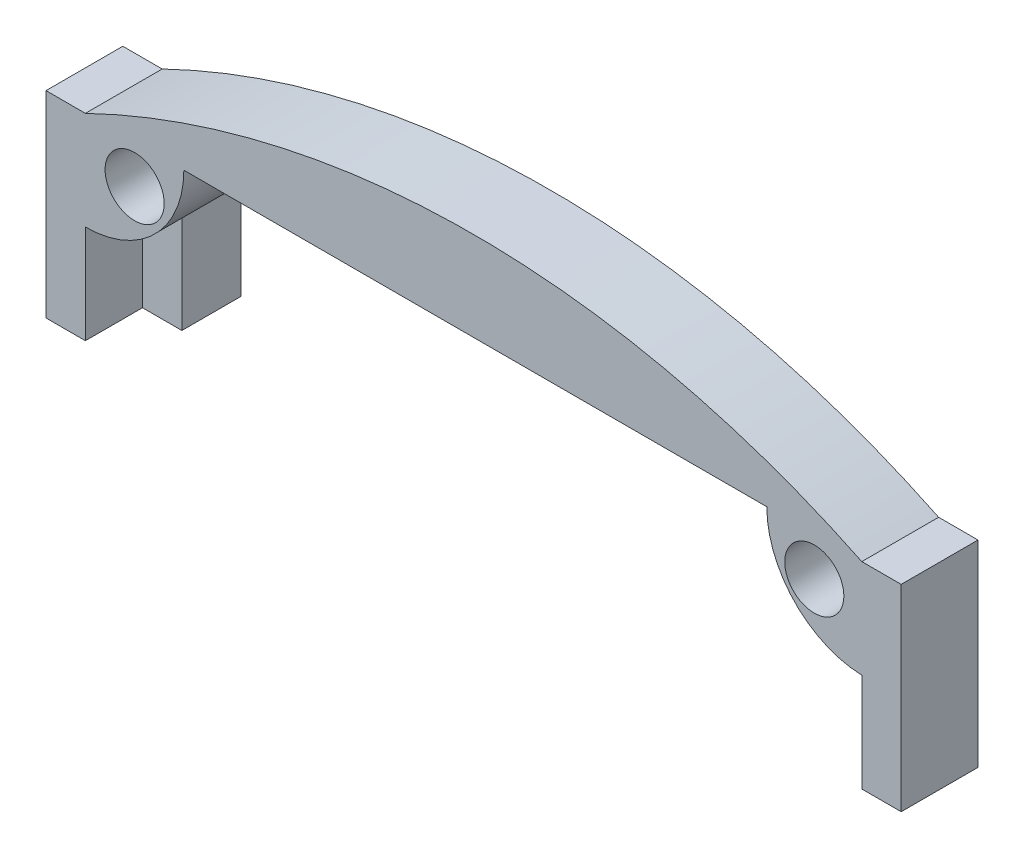
from build123d import *

# Parameters (mm, degrees)
CROQUIS1_R                     = 1.5
SALIENTE_EXTRUIR1_DEPTH        = 3.9
SALIENTE_EXTRUIR2_DEPTH        = 3.9
SALIENTE_EXTRUIR4_DEPTH        = 1
SALIENTE_EXTRUIR4_DEPTH_BACK   = 2
SALIENTE_EXTRUIR4_2_DEPTH      = 1
SALIENTE_EXTRUIR4_2_DEPTH_BACK = 2


with BuildPart() as part:
    # Croquis1 → Saliente-Extruir1 (new body)
    with BuildSketch(Plane.XY):
        with BuildLine():
            ThreePointArc((39.42330407, 0), (19.711652035, 4.533364671), (0, 0))
            Line((0, 0), (0, -5))
            ThreePointArc((0, -5), (3.535533906, -3.535533906), (5, 0))
            Line((5, 0), (34.6, 0))
            ThreePointArc((34.6, 0), (36.002537029, -3.472500565), (39.42330407, -4.996876879))
            Line((39.42330407, -4.996876879), (39.42330407, 0))
        make_face()
        with Locations((2.5, -1.972000375)):
            Circle(CROQUIS1_R, mode=Mode.SUBTRACT)
        with Locations((37.011652035, -1.972000375)):
            Circle(CROQUIS1_R, mode=Mode.SUBTRACT)
    extrude(amount=SALIENTE_EXTRUIR1_DEPTH)

    # Croquis3D3 → Saliente-Extruir2 (add)
    with BuildSketch(Plane(origin=(39.42330407, 0, 0), x_dir=(-0.9720754027566177, -0.2346687268375561, 0), z_dir=(0, 0, 1))):
        Polygon((0, 0), (-1.944150806, 0.469337454), (0.402536463, 10.190091481), (2.346687268, 9.720754028), align=None)
        Polygon((38.322424182, -9.251416574), (40.266574988, -9.720754028), (42.613262256, 0), (40.66911145, 0.469337454), align=None)
    extrude(amount=SALIENTE_EXTRUIR2_DEPTH)


with BuildPart() as body_2:
    # Croquis3D4 → Saliente-Extruir4 (new, two sides: drawn at the far end of the back side and taken through both)
    with BuildSketch(Plane(origin=(39.42330407, -4.996876879, 0), x_dir=(-0.9920431942742338, -0.12589797732360491, 0), z_dir=(0, 0, 1)).offset(-SALIENTE_EXTRUIR4_DEPTH_BACK)):
        Polygon((0, 0), (1.808796394, -0.229550294), (2.438679475, 4.733763947), (0.629883081, 4.963314242), align=None)
    extrude(amount=SALIENTE_EXTRUIR4_DEPTH + SALIENTE_EXTRUIR4_DEPTH_BACK)


with BuildPart() as body_3:
    # Croquis3D4 → Saliente-Extruir4 2 (new, two sides: drawn at the far end of the back side and taken through both)
    with BuildSketch(Plane(origin=(39.42330407, -4.996876879, 0), x_dir=(-0.9920431942742338, -0.12589797732360491, 0), z_dir=(0, 0, 1)).offset(-SALIENTE_EXTRUIR4_2_DEPTH_BACK)):
        Polygon((39.73950358, 0), (39.110013693, -4.960215971), (37.125927305, -4.708420017), (37.755417191, 0.251795955), align=None)
    extrude(amount=SALIENTE_EXTRUIR4_2_DEPTH + SALIENTE_EXTRUIR4_2_DEPTH_BACK)


solid = Compound([part.part, body_2.part, body_3.part])
